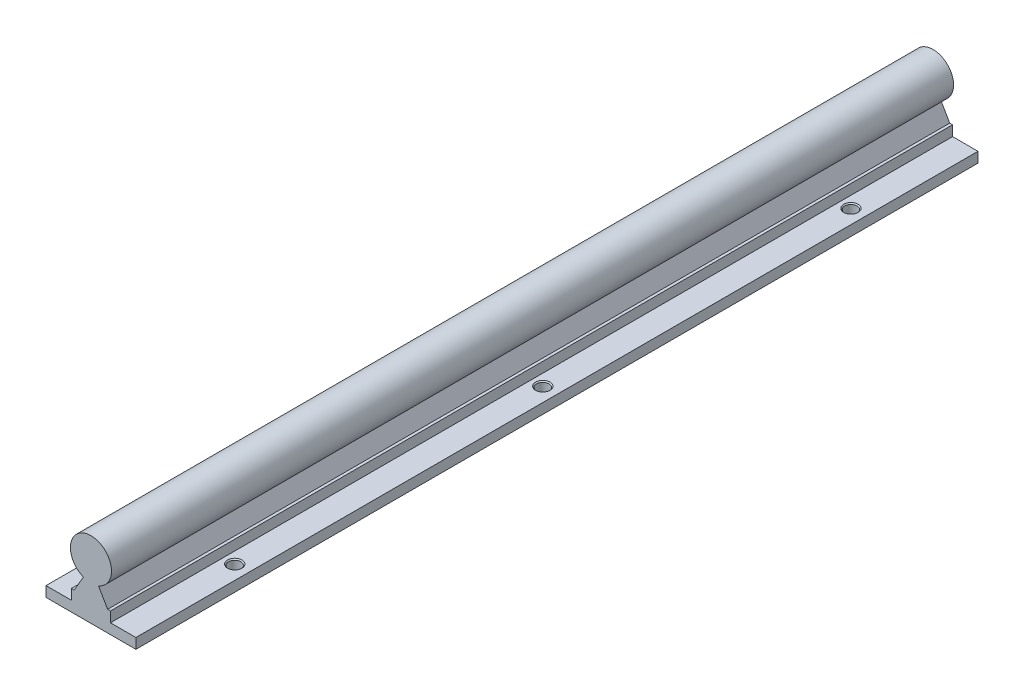
from build123d import *

# Parameters (mm, degrees)
SALIENTE_EXTRUIR1_DEPTH = 205
CORTAR_EXTRUIR1_REACH   = 211.458
CROQUIS2_R              = 3
CHAFL_N1_SIZE           = 0.5


with BuildPart() as part:
    # Croquis1 → Saliente-Extruir1 (new, symmetric)
    with BuildSketch(Plane.XY):
        with BuildLine():
            Line((-8.121192263, 10), (-3.67559519, 17.7))
            ThreePointArc((-3.67559519, 17.7), (0, 37), (3.67559519, 17.7))
            Line((3.67559519, 17.7), (8.121192263, 10))
            Line((8.121192263, 10), (9.5, 10))
            Line((9.5, 10), (9.5, 5))
            Line((9.5, 5), (21.88, 5))
            Line((21.88, 5), (21.88, 0))
            Line((21.88, 0), (-21.88, 0))
            Line((-21.88, 0), (-21.88, 5))
            Line((-21.88, 5), (-9.5, 5))
            Line((-9.5, 5), (-9.5, 10))
            Line((-9.5, 10), (-8.121192263, 10))
        make_face()
    extrude(amount=SALIENTE_EXTRUIR1_DEPTH, both=True)

    # Croquis2 → Cortar-Extruir1 (cut, up to next)
    with BuildSketch(Plane.XZ, mode=Mode.PRIVATE) as cortar_extruir1_sk1:
        with Locations(Location((15, 150, 0), (0, 0, 270))):
            Circle(CROQUIS2_R)
    cortar_extruir1_tool1 = extrude(cortar_extruir1_sk1.sketch, amount=-CORTAR_EXTRUIR1_REACH, mode=Mode.PRIVATE) & part.part
    # Croquis2 → Cortar-Extruir1 (cut, up to next)
    with BuildSketch(Plane.XZ, mode=Mode.PRIVATE) as cortar_extruir1_sk2:
        with Locations(Location((-15, 150, 0), (0, 0, 270))):
            Circle(CROQUIS2_R)
    cortar_extruir1_tool2 = extrude(cortar_extruir1_sk2.sketch, amount=-CORTAR_EXTRUIR1_REACH, mode=Mode.PRIVATE) & part.part
    # Croquis2 → Cortar-Extruir1 (cut, up to next)
    with BuildSketch(Plane.XZ, mode=Mode.PRIVATE) as cortar_extruir1_sk3:
        with Locations(Location((-15, 0, 0), (0, 0, 270))):
            Circle(CROQUIS2_R)
    cortar_extruir1_tool3 = extrude(cortar_extruir1_sk3.sketch, amount=-CORTAR_EXTRUIR1_REACH, mode=Mode.PRIVATE) & part.part
    # Croquis2 → Cortar-Extruir1 (cut, up to next)
    with BuildSketch(Plane.XZ, mode=Mode.PRIVATE) as cortar_extruir1_sk4:
        with Locations(Location((15, 0, 0), (0, 0, 270))):
            Circle(CROQUIS2_R)
    cortar_extruir1_tool4 = extrude(cortar_extruir1_sk4.sketch, amount=-CORTAR_EXTRUIR1_REACH, mode=Mode.PRIVATE) & part.part
    # Croquis2 → Cortar-Extruir1 (cut, up to next)
    with BuildSketch(Plane.XZ, mode=Mode.PRIVATE) as cortar_extruir1_sk5:
        with Locations(Location((15, -150, 0), (0, 0, 270))):
            Circle(CROQUIS2_R)
    cortar_extruir1_tool5 = extrude(cortar_extruir1_sk5.sketch, amount=-CORTAR_EXTRUIR1_REACH, mode=Mode.PRIVATE) & part.part
    # Croquis2 → Cortar-Extruir1 (cut, up to next)
    with BuildSketch(Plane.XZ, mode=Mode.PRIVATE) as cortar_extruir1_sk6:
        with Locations(Location((-15, -150, 0), (0, 0, 270))):
            Circle(CROQUIS2_R)
    cortar_extruir1_tool6 = extrude(cortar_extruir1_sk6.sketch, amount=-CORTAR_EXTRUIR1_REACH, mode=Mode.PRIVATE) & part.part
    add(cortar_extruir1_tool1.solids().sort_by_distance((15, 0, 150))[0], mode=Mode.SUBTRACT)
    add(cortar_extruir1_tool2.solids().sort_by_distance((-15, 0, 150))[0], mode=Mode.SUBTRACT)
    add(cortar_extruir1_tool3.solids().sort_by_distance((-15, 0, 0))[0], mode=Mode.SUBTRACT)
    add(cortar_extruir1_tool4.solids().sort_by_distance((15, 0, 0))[0], mode=Mode.SUBTRACT)
    add(cortar_extruir1_tool5.solids().sort_by_distance((15, 0, -150))[0], mode=Mode.SUBTRACT)
    add(cortar_extruir1_tool6.solids().sort_by_distance((-15, 0, -150))[0], mode=Mode.SUBTRACT)

    # Chaflán1
    chafl_n1_edges = [part.edges().sort_by_distance(p)[0] for p in [
        (-15, 5, 153),
        (-15, 5, 3),
        (15, 5, 3),
        (15, 5, -147),
        (-15, 5, -147),
        (15, 5, 153),
    ]]
    chamfer(chafl_n1_edges, length=CHAFL_N1_SIZE)


solid = part.part
